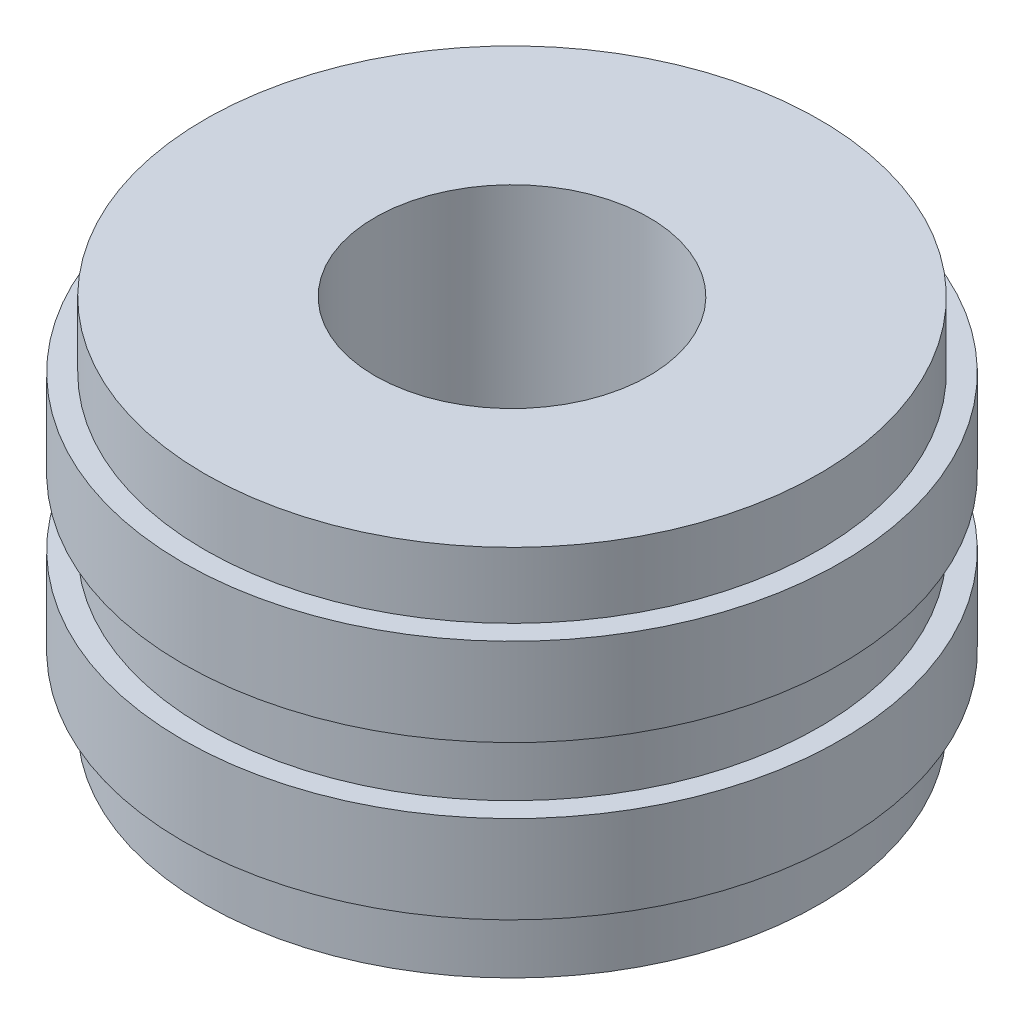
from build123d import *

# Parameters (mm, degrees)
SKETCH_1_R             = 30
SKETCH_1_R_2           = 12.5
EXTRUDE_1_DEPTH        = 34
CUT_EXTRUDE_START      = -6
SKETCH_2_R             = 30
SKETCH_2_R_2           = 28
CUT_EXTRUDE_1_DEPTH    = 6
PATTERN_LINEAR_1_COUNT = 3
PATTERN_LINEAR_1_PITCH = 14


with BuildPart() as part:
    # 草图1 → 凸台-拉伸1 (new body)
    with BuildSketch(Plane(origin=(0, 0, 0), x_dir=(1, 0, 0), z_dir=(0, 1, 0))):
        with Locations(Location((0, 0, 0), (0, 0, 270))):
            Circle(SKETCH_1_R)
        with Locations(Location((0, 0, 0), (0, 0, 270))):
            Circle(SKETCH_1_R_2, mode=Mode.SUBTRACT)
    extrude(amount=EXTRUDE_1_DEPTH)

    # 草图2 → 切除-拉伸1 (cut)
    with BuildSketch(Plane(origin=(0, 34, 0), x_dir=(1, 0, 0), z_dir=(0, 1, 0)).offset(CUT_EXTRUDE_START)):
        with Locations(Location((0, 0, 0), (0, 0, 270))):
            Circle(SKETCH_2_R)
        with Locations(Location((0, 0, 0), (0, 0, 270))):
            Circle(SKETCH_2_R_2, mode=Mode.SUBTRACT)
    cut_extrude_1 = extrude(amount=CUT_EXTRUDE_1_DEPTH, mode=Mode.SUBTRACT)

    # 阵列(线性)1: 切除-拉伸1 ×3
    with Locations(*[(0, -i * PATTERN_LINEAR_1_PITCH, 0) for i in range(1, PATTERN_LINEAR_1_COUNT)]):
        add(cut_extrude_1, mode=Mode.SUBTRACT)


solid = part.part
